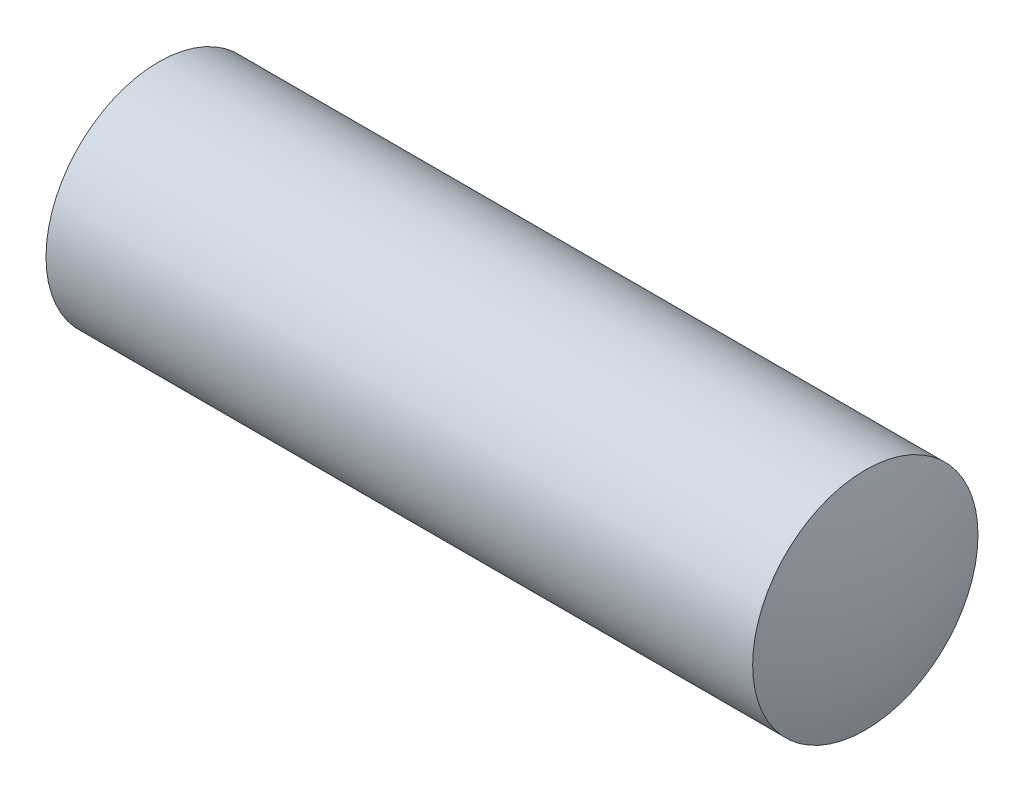
from build123d import *


with BuildPart() as part:
    # Эскиз1 → Повернуть1 (revolve)
    with BuildSketch(Plane.XY):
        with BuildLine():
            Line((18.803975315, 6), (-18.828784028, 6))
            ThreePointArc((-18.828784028, 6), (-19.518354516, 3.035153986), (-19.75, 0))
            Line((-19.75, 0), (19.75, 0))
            ThreePointArc((19.75, 0), (19.51204193, 3.037061191), (18.803975315, 6))
        make_face()
    revolve(axis=Axis((-19.959676553, 0, 0), (1, 0, 0)))


solid = part.part
